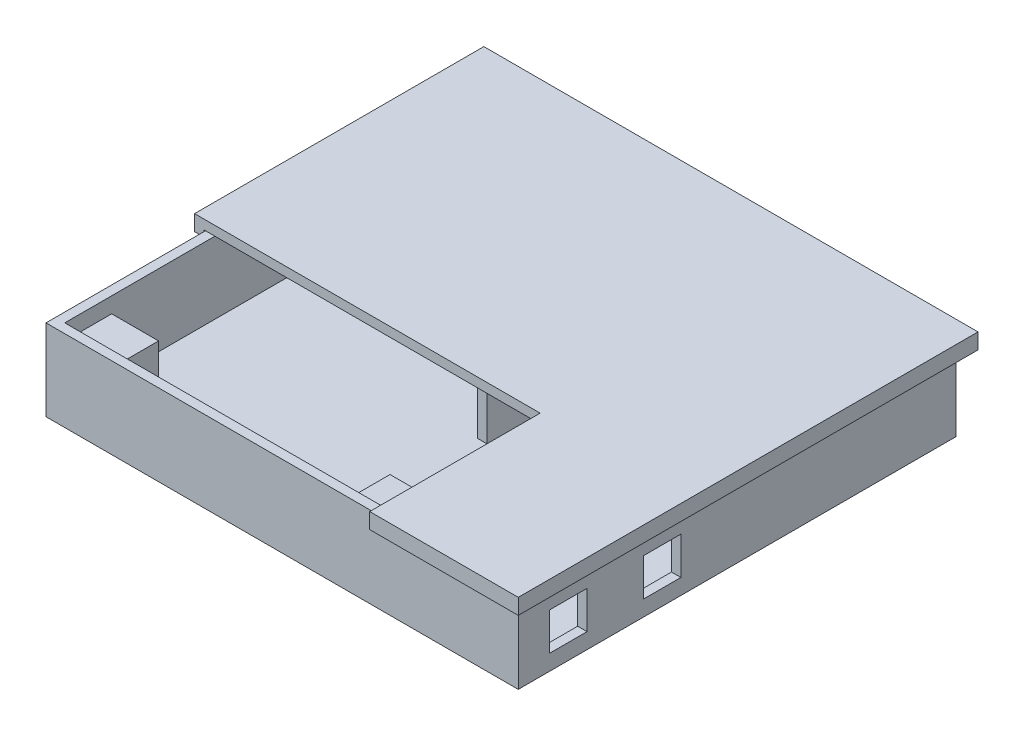
from build123d import *

# Parameters (mm, degrees)
SKETCH2_W           = 151
SKETCH2_H           = 140
SKETCH2_W_2         = 145
SKETCH2_H_2         = 134
BOSS_EXTRUDE1_DEPTH = 26
SKETCH2_2_W         = 145
SKETCH2_2_H         = 134
BOSS_EXTRUDE2_DEPTH = 3
SKETCH3_W           = 128
SKETCH3_H           = 3
CUT_EXTRUDE1_DEPTH  = 23
SKETCH4_W           = 12
SKETCH4_H           = 12
CUT_EXTRUDE2_DEPTH  = 23
BOSS_EXTRUDE3_DEPTH = 15
SKETCH6_W           = 15
SKETCH6_H           = 15
BOSS_EXTRUDE4_DEPTH = 18
BOSS_EXTRUDE5_DEPTH = 3
SKETCH8_W           = 3
SKETCH8_H           = 92.5
BOSS_EXTRUDE6_DEPTH = 2
SKETCH9_W           = 155
SKETCH9_H           = 3
BOSS_EXTRUDE7_DEPTH = 2


with BuildPart() as part:
    # Sketch2 → Boss-Extrude1 (new body)
    with BuildSketch(Plane(origin=(0, 0, 0), x_dir=(1, 0, 0), z_dir=(0, 1, 0))):
        Rectangle(SKETCH2_W, SKETCH2_H)
        Rectangle(SKETCH2_W_2, SKETCH2_H_2, mode=Mode.SUBTRACT)
    extrude(amount=BOSS_EXTRUDE1_DEPTH)

    # Sketch2<2> → Boss-Extrude2 (add)
    with BuildSketch(Plane(origin=(0, 0, 0), x_dir=(1, 0, 0), z_dir=(0, 1, 0))):
        Rectangle(SKETCH2_2_W, SKETCH2_2_H)
    extrude(amount=BOSS_EXTRUDE2_DEPTH)

    # Sketch3 → Cut-Extrude1 (cut)
    with BuildSketch(Plane(origin=(0, 26, 0), x_dir=(1, 0, 0), z_dir=(0, 1, 0))):
        with Locations((8.5, 68.5)):
            Rectangle(SKETCH3_W, SKETCH3_H)
    extrude(amount=-CUT_EXTRUDE1_DEPTH, mode=Mode.SUBTRACT)

    # Sketch4 → Cut-Extrude2 (cut)
    with BuildSketch(Plane(origin=(75.5, 0, 0), x_dir=(0, 0, -1), z_dir=(1, 0, 0))):
        with Locations((-54, 11)):
            Rectangle(SKETCH4_W, SKETCH4_H)
        with Locations((-24, 11)):
            Rectangle(SKETCH4_W, SKETCH4_H)
    extrude(amount=-CUT_EXTRUDE2_DEPTH, mode=Mode.SUBTRACT)

    # Sketch5 → Boss-Extrude3 (add)
    with BuildSketch(Plane(origin=(0, 3, 0), x_dir=(1, 0, 0), z_dir=(0, 1, 0))):
        Polygon((5.5, 70), (2.5, 70), (2.5, -10), (5.5, -10), (5.5, 22), (40.5, 22), (40.5, 25), (5.5, 25), align=None)
    extrude(amount=BOSS_EXTRUDE3_DEPTH)

    # Sketch6 → Boss-Extrude4 (add)
    with BuildSketch(Plane(origin=(0, 3, 0), x_dir=(1, 0, 0), z_dir=(0, 1, 0))):
        with Locations((-65, -59.5)):
            Rectangle(SKETCH6_W, SKETCH6_H)
        with Locations((24, -59.5)):
            Rectangle(SKETCH6_W, SKETCH6_H)
    extrude(amount=BOSS_EXTRUDE4_DEPTH)


with BuildPart() as body_2:
    # Sketch7 → Boss-Extrude5 (new body)
    with BuildSketch(Plane(origin=(0, 26, 0), x_dir=(1, 0, 0), z_dir=(0, 1, 0))):
        Polygon((79, 73.5), (-79, 73.5), (-79, -19), (31.5, -19), (31.5, -73.5), (79, -73.5), align=None)
    extrude(amount=BOSS_EXTRUDE5_DEPTH)

    # Sketch8 → Boss-Extrude6 (add)
    with BuildSketch(Plane.XZ.offset(-26)):
        with Locations((-77.5, -27.25)):
            Rectangle(SKETCH8_W, SKETCH8_H)
        Polygon((76, 70.5), (76, -70.5), (79, -70.5), (79, 73.5), (31.5, 73.5), (31.5, 70.5), align=None)
    extrude(amount=BOSS_EXTRUDE6_DEPTH)

    # Sketch9 → Boss-Extrude7 (add)
    with BuildSketch(Plane(origin=(0, 26, 0), x_dir=(-1, 0, 0), z_dir=(0, -1, 0))):
        with Locations((-1.5, 72)):
            Rectangle(SKETCH9_W, SKETCH9_H)
    extrude(amount=BOSS_EXTRUDE7_DEPTH)


solid = Compound([part.part, body_2.part])
